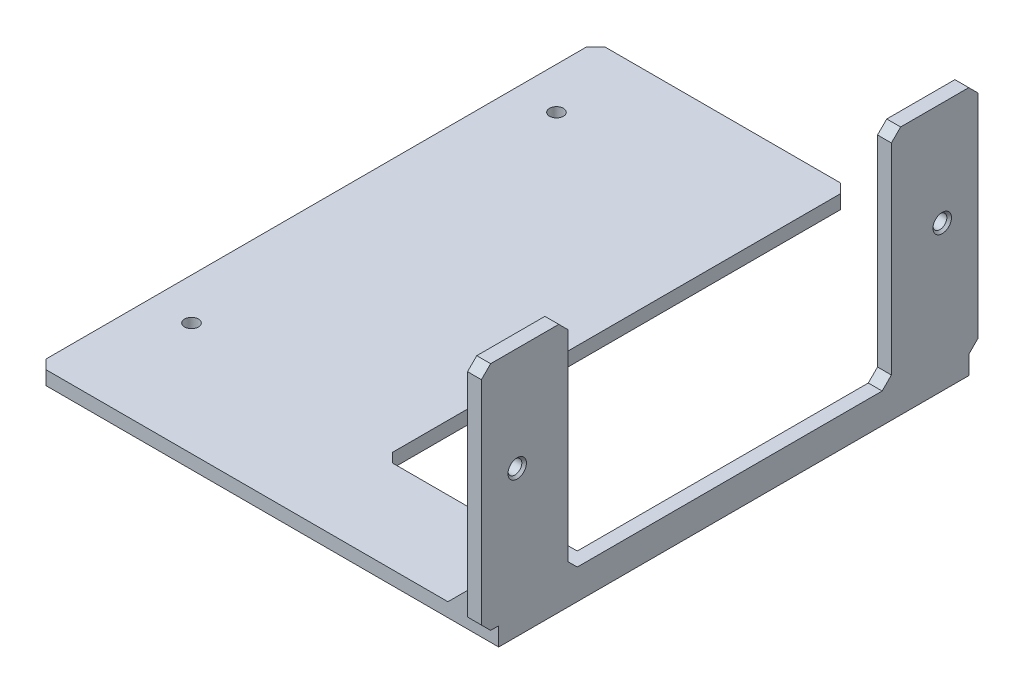
from build123d import *

# Parameters (mm, degrees)
SKETCH_1_W               = 107.5
SKETCH_1_H               = 50
EXTRUDE_1_DEPTH          = 3
CHAMFER_1_SIZE           = 2
CUT_EXTRUDE_1_DEPTH      = 61.450909836
CUT_EXTRUDE_1_DEPTH_BACK = 61.450909836
SKETCH_3_R               = 1.5
CHAMFER_2_SIZE           = 0.5
SKETCH_4_W               = 20
SKETCH_4_H               = 1
EXTRUDE_2_DEPTH          = 3
EXTRUDE_3_DEPTH          = 3
EXTRUDE_4_DEPTH          = 20
SKETCH_7_R               = 1.5
CUT_EXTRUDE_2_DEPTH      = 30
SKETCH_8_W               = 70
SKETCH_8_H               = 47.5
CUT_EXTRUDE_3_DEPTH      = 10
CHAMFER_5_SIZE           = 2
CHAMFER_6_SIZE           = 2
CHAMFER_7_SIZE           = 2
SKETCH_9_W               = 3
SKETCH_9_H               = 81.75
EXTRUDE_5_DEPTH          = 4


with BuildPart() as part:
    # 草图1 → 凸台-拉伸1 (new body)
    with BuildSketch(Plane(origin=(0, 0, 0), x_dir=(0, 0, -1), z_dir=(1, 0, 0))):
        with Locations((0, -2.5)):
            Rectangle(SKETCH_1_W, SKETCH_1_H)
    extrude(amount=EXTRUDE_1_DEPTH)

    # 倒角1
    chamfer_1_edges = [part.edges().sort_by_distance(p)[0] for p in [
        (1.5, 22.5, 53.75),
        (1.5, 22.5, -53.75),
        (1.5, -27.5, -53.75),
        (1.5, -27.5, 53.75),
    ]]
    chamfer(chamfer_1_edges, length=CHAMFER_1_SIZE)

    # 草图3 → 切除-拉伸1 (cut, two sides: drawn at the far end of the back side and taken through both)
    with BuildSketch(Plane(origin=(3, 0, 0), x_dir=(0, 0, -1), z_dir=(1, 0, 0)).offset(-CUT_EXTRUDE_1_DEPTH_BACK)):
        with Locations((46, 0)):
            Circle(SKETCH_3_R)
        with Locations((-46, 0)):
            Circle(SKETCH_3_R)
    extrude(amount=CUT_EXTRUDE_1_DEPTH + CUT_EXTRUDE_1_DEPTH_BACK, mode=Mode.SUBTRACT)

    # 倒角2
    chamfer_2_edges = [part.edges().sort_by_distance(p)[0] for p in [
        (3, 0, -44.5),
        (3, 0, 47.5),
    ]]
    chamfer(chamfer_2_edges, length=CHAMFER_2_SIZE)


with BuildPart() as body_2:
    # 草图4 → 凸台-拉伸2 (new body)
    with BuildSketch(Plane(origin=(3, 0, 0), x_dir=(0, 0, -1), z_dir=(1, 0, 0))):
        with Locations((-40, -28)):
            Rectangle(SKETCH_4_W, SKETCH_4_H)
    extrude(amount=-EXTRUDE_2_DEPTH)

    # 草图5 → 凸台-拉伸3 (add)
    with BuildSketch(Plane.XZ.offset(28.5)):
        Polygon((3, 50), (3, 30), (-42, 30), (-42, -71), (-97, -71), (-97, 50), align=None)
    extrude(amount=EXTRUDE_3_DEPTH)

    # 草图6 → 凸台-拉伸4 (add)
    with BuildSketch(Plane(origin=(0, 0, 30), x_dir=(-1, 0, 0), z_dir=(0, 0, -1))):
        Polygon((0, -20.5), (8, -28.5), (0, -28.5), align=None)
    extrude(amount=-EXTRUDE_4_DEPTH)

    # 草图7 → 切除-拉伸2 (cut)
    with BuildSketch(Plane(origin=(0, -28.5, 0), x_dir=(1, 0, 0), z_dir=(0, 1, 0))):
        with Locations(Location((-88, 53.5, 0), (0, 0, 270))):
            Circle(SKETCH_7_R)
        with Locations(Location((-88, -25.5, 0), (0, 0, 270))):
            Circle(SKETCH_7_R)
    extrude(amount=-CUT_EXTRUDE_2_DEPTH, mode=Mode.SUBTRACT)


with BuildPart() as part_1:
    add(part.part)

    # Combine 1: union body 2
    add(body_2.part)

    # 草图8 → 切除-拉伸3 (cut)
    with BuildSketch(Plane(origin=(3, 0, 0), x_dir=(0, 0, -1), z_dir=(1, 0, 0))):
        with Locations((0, -1.25)):
            Rectangle(SKETCH_8_W, SKETCH_8_H)
    extrude(amount=-CUT_EXTRUDE_3_DEPTH, mode=Mode.SUBTRACT)

    # 倒角5
    chamfer_5_edges = [part_1.edges().sort_by_distance(p)[0] for p in [
        (-0.75, -25, 35),
        (1.5, -25, -35),
    ]]
    chamfer(chamfer_5_edges, length=CHAMFER_5_SIZE)

    # 倒角6
    chamfer_6_edges = [part_1.edges().sort_by_distance(p)[0] for p in [
        (1.5, 22.5, 35),
        (1.5, 22.5, -35),
    ]]
    chamfer(chamfer_6_edges, length=CHAMFER_6_SIZE)

    # 倒角7
    chamfer_7_edges = [part_1.edges().sort_by_distance(p)[0] for p in [
        (-42, -30, 30),
        (-97, -30, 50),
        (-97, -30, -71),
        (-42, -30, -71),
    ]]
    chamfer(chamfer_7_edges, length=CHAMFER_7_SIZE)

    # 草图9 → 凸台-拉伸5 (add)
    with BuildSketch(Plane.XZ.offset(27.5)):
        with Locations((1.5, -10.875)):
            Rectangle(SKETCH_9_W, SKETCH_9_H)
    extrude(amount=EXTRUDE_5_DEPTH)


solid = part_1.part
